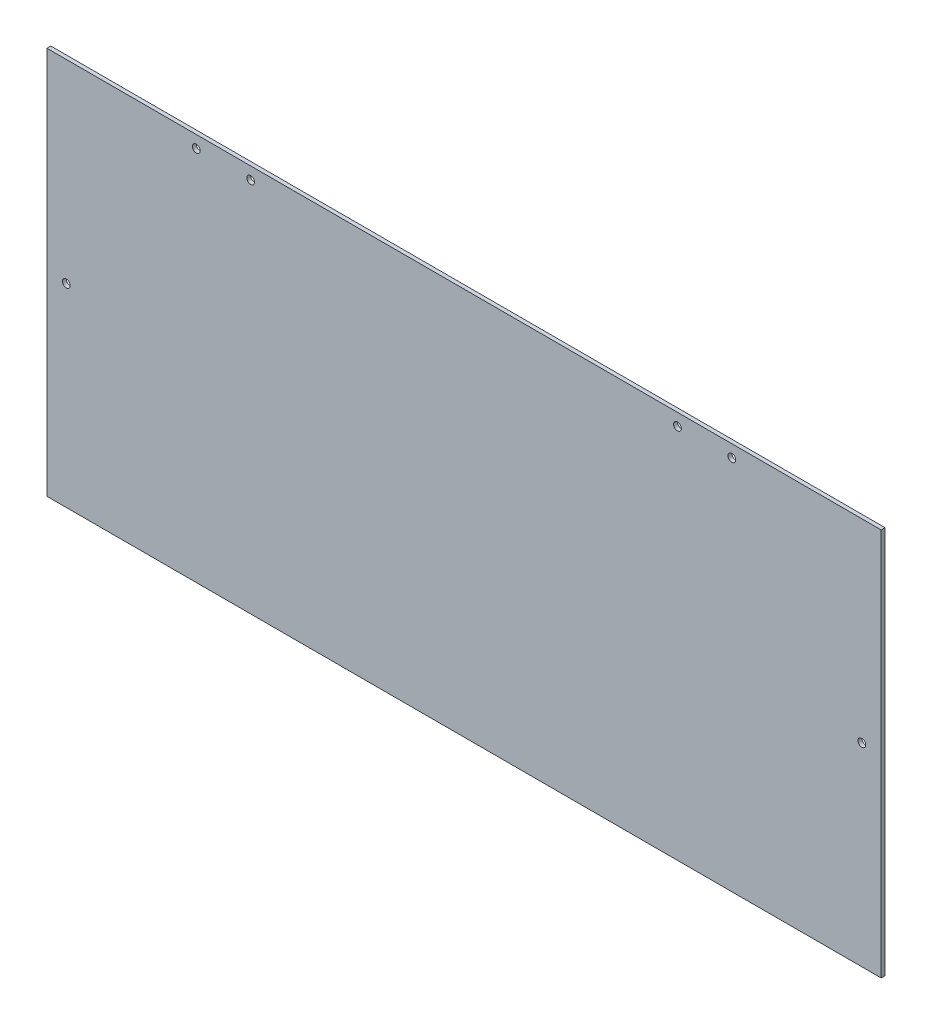
from build123d import *

# Parameters (mm, degrees)
SKETCH_1_W      = 430
SKETCH_1_H      = 200
SKETCH_1_R      = 2
EXTRUDE_1_DEPTH = 2


with BuildPart() as part:
    # 草图1 → 凸台-拉伸1 (new body)
    with BuildSketch(Plane.XY):
        with Locations((215, -100)):
            Rectangle(SKETCH_1_W, SKETCH_1_H)
        with Locations((10, -100)):
            Circle(SKETCH_1_R, mode=Mode.SUBTRACT)
        with Locations((420, -100)):
            Circle(SKETCH_1_R, mode=Mode.SUBTRACT)
        with Locations((77, -6.3)):
            Circle(SKETCH_1_R, mode=Mode.SUBTRACT)
        with Locations((105, -6.3)):
            Circle(SKETCH_1_R, mode=Mode.SUBTRACT)
        with Locations(Location((325, -6.3, 0), (0, 0, 180))):
            Circle(SKETCH_1_R, mode=Mode.SUBTRACT)
        with Locations(Location((353, -6.3, 0), (0, 0, 180))):
            Circle(SKETCH_1_R, mode=Mode.SUBTRACT)
    extrude(amount=EXTRUDE_1_DEPTH)


solid = part.part
